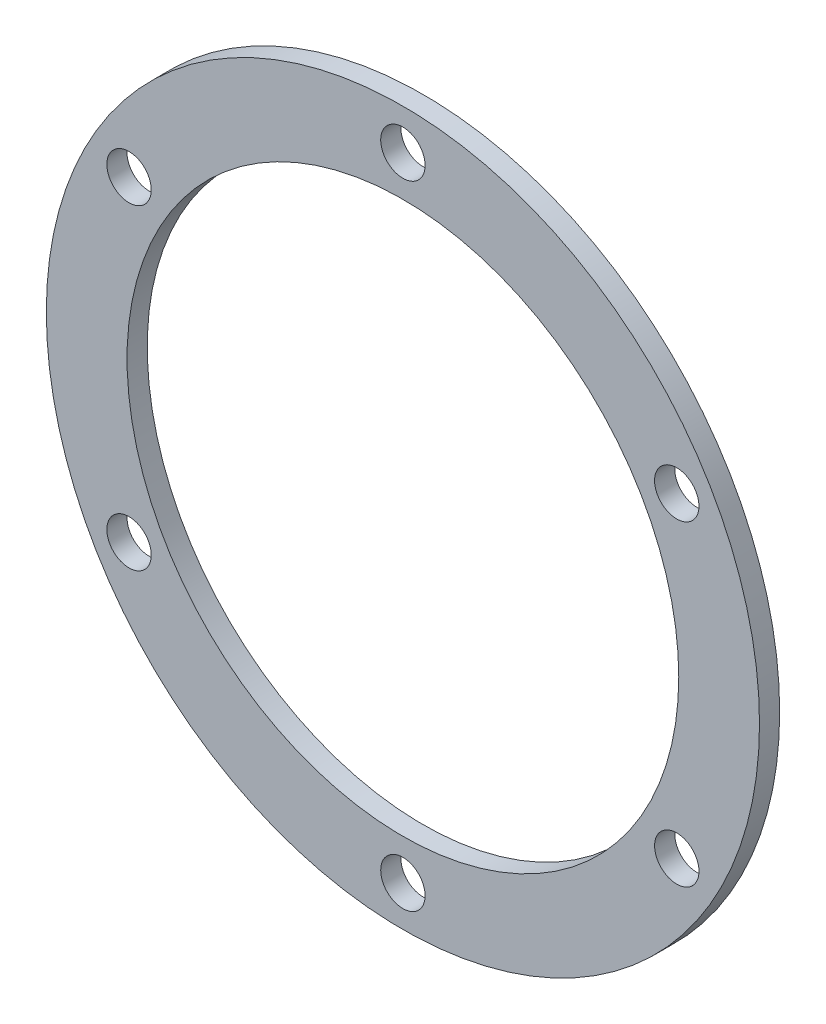
from build123d import *

# Parameters (mm, degrees)
SKETCH_1_R               = 26.5
SKETCH_1_R_2             = 20.5
EXTRUDE_1_DEPTH          = 1.5
SKETCH_2_R               = 1.65
CUT_EXTRUDE_1_DEPTH      = 1.5
PATTERN_CIRCULAR_1_COUNT = 6


with BuildPart() as part:
    # 草图1 → 凸台-拉伸1 (new body)
    with BuildSketch(Plane.XY):
        Circle(SKETCH_1_R)
        Circle(SKETCH_1_R_2, mode=Mode.SUBTRACT)
    extrude(amount=EXTRUDE_1_DEPTH)

    # 草图2 → 切除-拉伸1 (cut)
    with BuildSketch(Plane.XY.offset(1.5)):
        with Locations((0, 23.5)):
            Circle(SKETCH_2_R)
    cut_extrude_1 = extrude(amount=-CUT_EXTRUDE_1_DEPTH, mode=Mode.SUBTRACT)

    # 阵列(圆周)1: 切除-拉伸1 ×6 about axis
    pattern_circular_1_axis = Axis((0, 0, 0), (0, 0, 1))
    for i in range(1, PATTERN_CIRCULAR_1_COUNT):
        add(cut_extrude_1.rotate(pattern_circular_1_axis, i * 360 / PATTERN_CIRCULAR_1_COUNT), mode=Mode.SUBTRACT)


solid = part.part
